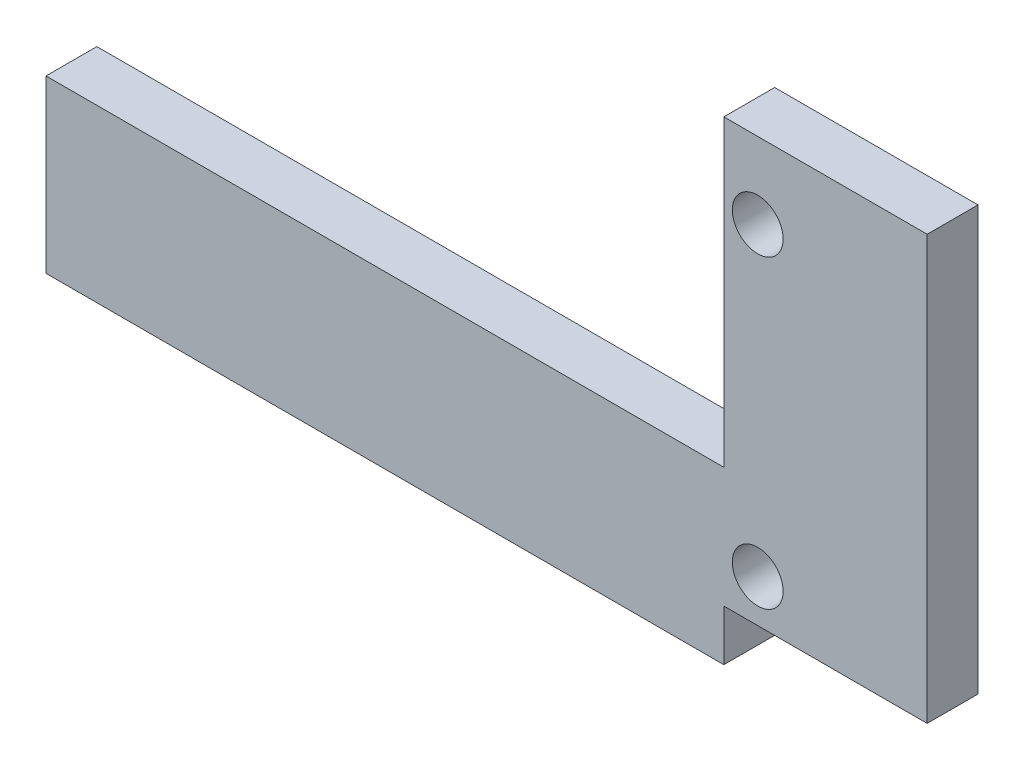
from build123d import *

# Parameters (mm, degrees)
SKETCH1_W           = 12
SKETCH1_H           = 25
BOSS_EXTRUDE1_DEPTH = 3
SKETCH2_R           = 1.5
CUT_EXTRUDE2_DEPTH  = 40
SKETCH4_W           = 3
SKETCH4_H           = 14.090179648
BOSS_EXTRUDE3_DEPTH = 40
SKETCH5_W           = 40
SKETCH5_H           = 3.999871266
CUT_EXTRUDE3_DEPTH  = 10


with BuildPart() as part:
    # Sketch1 → Boss-Extrude1 (new body)
    with BuildSketch(Plane.XY):
        with Locations((-6, 12.5)):
            Rectangle(SKETCH1_W, SKETCH1_H)
    extrude(amount=BOSS_EXTRUDE1_DEPTH)

    # Sketch2 → Cut-Extrude2 (cut)
    with BuildSketch(Plane(origin=(0, 0, 0), x_dir=(-1, 0, 0), z_dir=(0, 0, -1))):
        with Locations((10, 2.5)):
            Circle(SKETCH2_R)
        with Locations((10, 20.5)):
            Circle(SKETCH2_R)
    extrude(amount=-CUT_EXTRUDE2_DEPTH, mode=Mode.SUBTRACT)

    # Sketch4 → Boss-Extrude3 (add)
    with BuildSketch(Plane.ZY.offset(12)):
        with Locations((1.5, 4.045089824)):
            Rectangle(SKETCH4_W, SKETCH4_H)
    extrude(amount=BOSS_EXTRUDE3_DEPTH)

    # Sketch5 → Cut-Extrude3 (cut)
    with BuildSketch(Plane(origin=(0, 0, 0), x_dir=(-1, 0, 0), z_dir=(0, 0, -1))):
        with Locations((32, 9.090244015)):
            Rectangle(SKETCH5_W, SKETCH5_H)
    extrude(amount=-CUT_EXTRUDE3_DEPTH, mode=Mode.SUBTRACT)


solid = part.part
